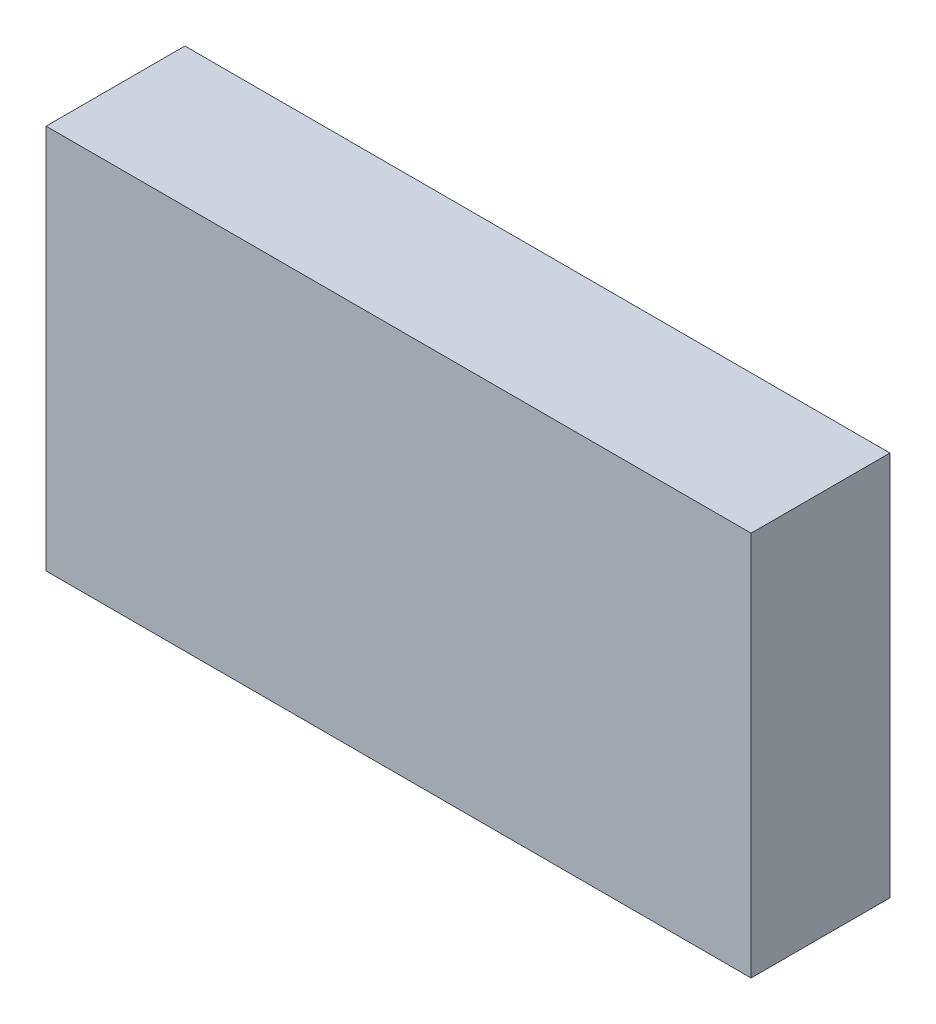
from build123d import *

# Parameters (mm, degrees)
SKETCH1_W               = 12.8999996
SKETCH1_H               = 7.0488048
COMPONENT_OUTLINE_DEPTH = 2.54


with BuildPart() as part:
    # Sketch1 → Component_Outline (new body)
    with BuildSketch(Plane.XY):
        with Locations((5.08, 2.1544026)):
            Rectangle(SKETCH1_W, SKETCH1_H)
    extrude(amount=COMPONENT_OUTLINE_DEPTH)


solid = part.part
